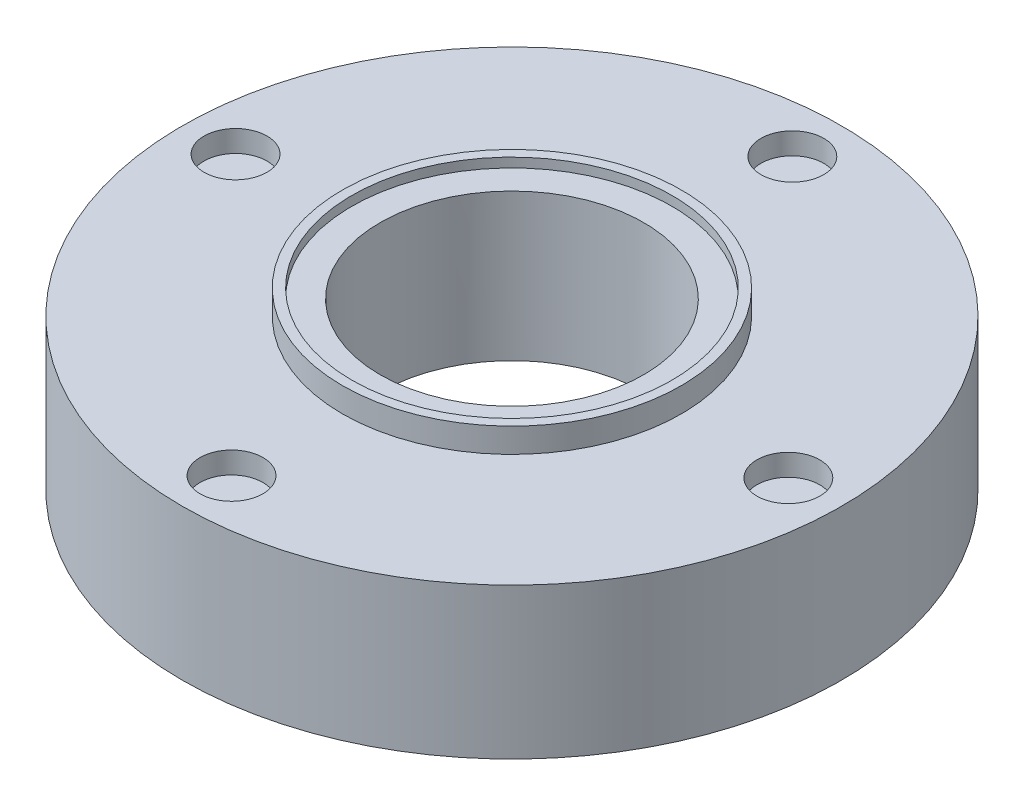
from build123d import *

# Parameters (mm, degrees)
SKETCH1_R           = 17.5
BOSS_EXTRUDE1_DEPTH = 8
SKETCH5_R           = 16.5
CUT_EXTRUDE2_DEPTH  = 1
SKETCH11_R          = 1.67
CUT_EXTRUDE5_DEPTH  = 1.15
CIRPATTERN1_COUNT   = 4
SKETCH13_R          = 9
SKETCH13_R_2        = 8.5
BOSS_EXTRUDE3_DEPTH = 1.3
SKETCH12_R          = 8.6
BOSS_EXTRUDE2_DEPTH = 0.8
SKETCH14_R          = 7
CUT_EXTRUDE6_DEPTH  = 27.266708968


with BuildPart() as part:
    # Sketch1 → Boss-Extrude1 (new body)
    with BuildSketch(Plane(origin=(0, 0, 0), x_dir=(1, 0, 0), z_dir=(0, 1, 0))):
        with Locations(Location((0, 0, 0), (0, 0, 270))):
            Circle(SKETCH1_R)
    extrude(amount=BOSS_EXTRUDE1_DEPTH)

    # Sketch5 → Cut-Extrude2 (cut)
    with BuildSketch(Plane.XZ):
        with Locations(Location((0, 0, 0), (0, 0, 270))):
            Circle(SKETCH5_R)
    extrude(amount=-CUT_EXTRUDE2_DEPTH, mode=Mode.SUBTRACT)

    # Sketch11 → Cut-Extrude5 (cut)
    with BuildSketch(Plane(origin=(0, 8, 0), x_dir=(1, 0, 0), z_dir=(0, 1, 0))):
        with Locations(Location((0.106708516, 14.783412681, 0), (0, 0, 270))):
            Circle(SKETCH11_R)
    cut_extrude5 = extrude(amount=-CUT_EXTRUDE5_DEPTH, mode=Mode.SUBTRACT)

    # CirPattern1: Cut-Extrude5 ×4 about axis
    cirpattern1_axis = Axis((0, 0, 0), (0, 1, 0))
    for i in range(1, CIRPATTERN1_COUNT):
        add(cut_extrude5.rotate(cirpattern1_axis, i * 360 / CIRPATTERN1_COUNT), mode=Mode.SUBTRACT)

    # Sketch13 → Boss-Extrude3 (add)
    with BuildSketch(Plane(origin=(0, 8, 0), x_dir=(1, 0, 0), z_dir=(0, 1, 0))):
        with Locations(Location((0, 0, 0), (0, 0, 270))):
            Circle(SKETCH13_R)
        with Locations(Location((0, 0, 0), (0, 0, 270))):
            Circle(SKETCH13_R_2, mode=Mode.SUBTRACT)
    extrude(amount=BOSS_EXTRUDE3_DEPTH)

    # Sketch12 → Boss-Extrude2 (add)
    with BuildSketch(Plane(origin=(0, 8, 0), x_dir=(1, 0, 0), z_dir=(0, 1, 0))):
        Circle(SKETCH12_R)
    extrude(amount=BOSS_EXTRUDE2_DEPTH)

    # Sketch14 → Cut-Extrude6 (cut, through all)
    with BuildSketch(Plane(origin=(0, 8.8, 0), x_dir=(1, 0, 0), z_dir=(0, 1, 0))):
        with Locations(Location((0, 0, 0), (0, 0, 270))):
            Circle(SKETCH14_R)
    extrude(amount=-CUT_EXTRUDE6_DEPTH, mode=Mode.SUBTRACT)


solid = part.part
